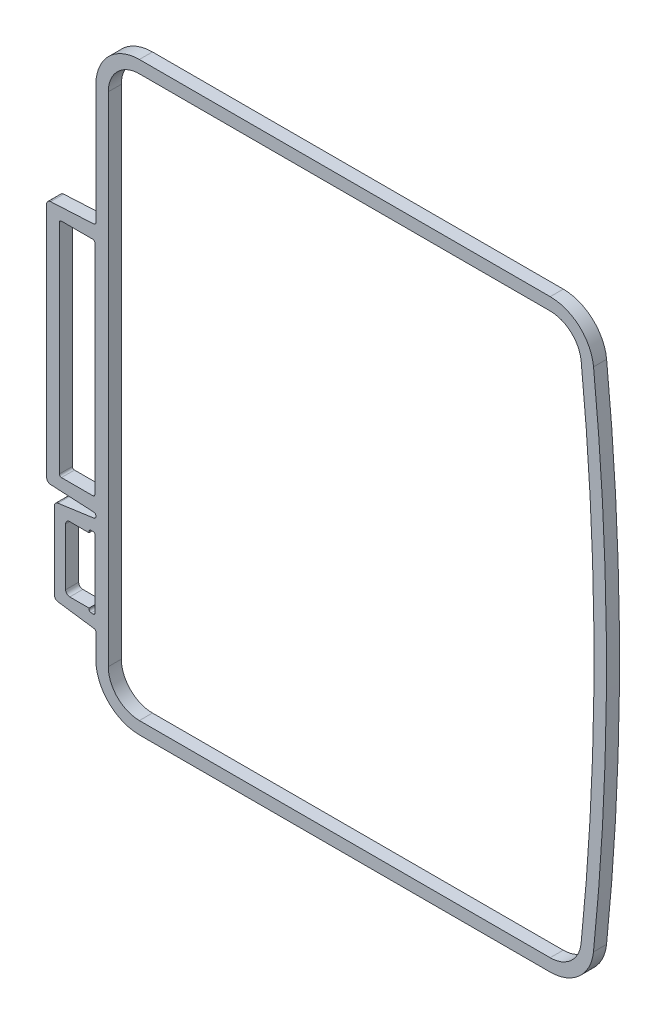
from build123d import *

# Parameters (mm, degrees)
SKETCH1_W           = 4.3434
SKETCH1_H           = 27.20594
BOSS_EXTRUDE1_DEPTH = 1.6002
FILLET1_R           = 0.508
FILLET2_R           = 0.508
FILLET3_R           = 0.254


with BuildPart() as part:
    # Sketch1 → Boss-Extrude1 (new body)
    with BuildSketch(Plane.XY):
        with BuildLine():
            Line((0, 51.4198), (-6.02742, 51.103916303))
            Line((-6.02742, 51.103916303), (-6.02742, 21.146463697))
            Line((-6.02742, 21.146463697), (0, 20.83058))
            Line((0, 20.83058), (0, 20.24638))
            Line((0, 20.24638), (-5.08, 19.53243256))
            Line((-5.08, 19.53243256), (-5.08, 9.19504744))
            Line((-5.08, 9.19504744), (0, 8.4811))
            Line((0, 8.4811), (0, 5.334))
            ThreePointArc((0, 5.334), (1.562292429, 1.562292429), (5.334, 0))
            Line((5.334, 0), (55.64639368, 0))
            ThreePointArc((55.64639368, 0), (59.220505665, 1.374545553), (60.952555507, 4.789754962))
            ThreePointArc((60.952555507, 4.789754962), (62.542276693, 35.823920719), (60.961816866, 66.858559503))
            ThreePointArc((60.961816866, 66.858559503), (59.230195601, 70.274819072), (55.65549286, 71.649897966))
            Line((55.65549286, 71.649897966), (5.334, 71.649897966))
            ThreePointArc((5.334, 71.649897966), (1.562292429, 70.087605537), (0, 66.315897966))
            Line((0, 66.315897966), (0, 51.4198))
        make_face()
        with BuildLine():
            Line((5.334, 70.125897966), (55.65549286, 70.125897966))
            ThreePointArc((55.65549286, 70.125897966), (58.208851961, 69.143698756), (59.445724293, 66.70351335))
            ThreePointArc((59.445724293, 66.70351335), (61.01827671, 35.824148117), (59.436509271, 4.945253544))
            ThreePointArc((59.436509271, 4.945253544), (58.199330812, 2.505818252), (55.64639368, 1.524))
            Line((55.64639368, 1.524), (5.334, 1.524))
            ThreePointArc((5.334, 1.524), (2.639923164, 2.639923164), (1.524, 5.334))
            Line((1.524, 5.334), (1.524, 66.315897966))
            ThreePointArc((1.524, 66.315897966), (2.639923164, 69.009974802), (5.334, 70.125897966))
        make_face(mode=Mode.SUBTRACT)
        with Locations((-2.2987, 36.12519)):
            Rectangle(SKETCH1_W, SKETCH1_H, mode=Mode.SUBTRACT)
        Polygon((-0.8382, 18.35662), (-3.70332, 18.35662), (-3.70332, 10.3734), (-0.8382, 10.3734), (-0.8382, 9.9924), (-0.0762, 9.9924), (-0.0762, 18.73762), (-0.8382, 18.73762), align=None, mode=Mode.SUBTRACT)
    extrude(amount=BOSS_EXTRUDE1_DEPTH)

    # Fillet1
    fillet1_edges = [part.edges().sort_by_distance(p)[0] for p in [
        (-3.70332, 18.35662, 0.8001),
        (-3.70332, 10.3734, 0.8001),
    ]]
    fillet(fillet1_edges, radius=FILLET1_R)

    # Fillet2
    fillet2_edges = [part.edges().sort_by_distance(p)[0] for p in [
        (-5.08, 9.19504744, 0.8001),
        (-5.08, 19.53243256, 0.8001),
        (-6.02742, 21.146463697, 0.8001),
        (-6.02742, 51.103916303, 0.8001),
    ]]
    fillet(fillet2_edges, radius=FILLET2_R)

    # Fillet3
    fillet3_edges = [part.edges().sort_by_distance(p)[0] for p in [
        (0, 8.4811, 0.8001),
        (0, 20.24638, 0.8001),
        (0, 20.83058, 0.8001),
        (0, 51.4198, 0.8001),
        (-0.127, 22.52222, 0.8001),
        (-0.127, 49.72816, 0.8001),
        (-4.4704, 49.72816, 0.8001),
        (-4.4704, 22.52222, 0.8001),
        (-0.8382, 9.9924, 0.8001),
        (-0.0762, 9.9924, 0.8001),
        (-0.0762, 18.73762, 0.8001),
        (-0.8382, 18.73762, 0.8001),
    ]]
    fillet(fillet3_edges, radius=FILLET3_R)


solid = part.part
